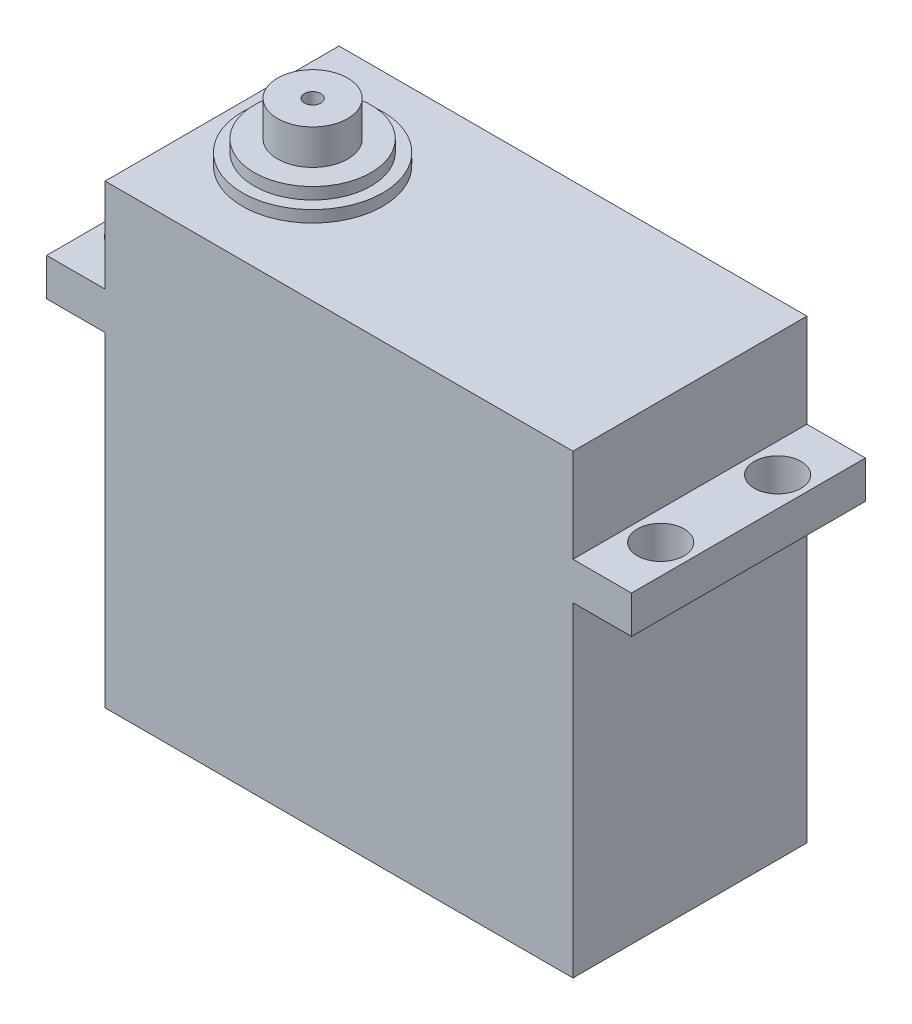
from build123d import *

# Parameters (mm, degrees)
SKETCH_1_W            = 40
SKETCH_1_H            = 39
EXTRUDE_1_DEPTH       = 20
SKETCH_4_W            = 20
SKETCH_4_H            = 3.215179838
EXTRUDE_2_DEPTH       = 5
SKETCH_5_W            = 20
SKETCH_5_H            = 3.215179838
EXTRUDE_3_DEPTH       = 5
SKETCH_7_R            = 2
CUT_EXTRUDE_2_DEPTH   = 3.21517984
SKETCH_8_R            = 2
CUT_EXTRUDE_3_DEPTH   = 3.21517984
EXTRUDE_7_DEPTH       = 1
EXTRUDE_7_DEPTH_BACK  = 39
SKETCH_9_R            = 6
EXTRUDE_9_DEPTH       = 1
EXTRUDE_9_DEPTH_BACK  = 40
SKETCH_10_R           = 5
EXTRUDE_10_DEPTH      = 3
EXTRUDE_10_DEPTH_BACK = 41
SKETCH_11_R           = 3
SKETCH_12_R           = 0.705262345
CUT_EXTRUDE_4_DEPTH   = 40


with BuildPart() as part:
    # 草图1 → 凸台-拉伸1 (new body)
    with BuildSketch(Plane.XY):
        with Locations((-12.988047809, 18.294260929)):
            Rectangle(SKETCH_1_W, SKETCH_1_H)
    extrude(amount=EXTRUDE_1_DEPTH)

    # 草图4 → 凸台-拉伸2 (add)
    with BuildSketch(Plane.ZY.offset(32.988047809)):
        with Locations((10, 28.18667101)):
            Rectangle(SKETCH_4_W, SKETCH_4_H)
    extrude(amount=EXTRUDE_2_DEPTH)

    # 草图5 → 凸台-拉伸3 (add)
    with BuildSketch(Plane(origin=(7.011952191, 0, 0), x_dir=(0, 0, -1), z_dir=(1, 0, 0))):
        with Locations((-10, 28.18667101)):
            Rectangle(SKETCH_5_W, SKETCH_5_H)
    extrude(amount=EXTRUDE_3_DEPTH)

    # 草图7 → 切除-拉伸2 (cut)
    with BuildSketch(Plane(origin=(0, 29.794260929, 0), x_dir=(1, 0, 0), z_dir=(0, 1, 0))):
        with Locations(Location((-35.488047809, -5.338978439, 0), (0, 0, 270))):
            Circle(SKETCH_7_R)
        with Locations(Location((-35.488047809, -14.731505131, 0), (0, 0, 270))):
            Circle(SKETCH_7_R)
    extrude(amount=-CUT_EXTRUDE_2_DEPTH, mode=Mode.SUBTRACT)

    # 草图8 → 切除-拉伸3 (cut)
    with BuildSketch(Plane(origin=(0, 29.794260929, 0), x_dir=(1, 0, 0), z_dir=(0, 1, 0))):
        with Locations(Location((9.511952191, -5, 0), (0, 0, 270))):
            Circle(SKETCH_8_R)
        with Locations(Location((9.511952191, -15, 0), (0, 0, 270))):
            Circle(SKETCH_8_R)
    extrude(amount=-CUT_EXTRUDE_3_DEPTH, mode=Mode.SUBTRACT)

    # 草图9 → 凸台-拉伸7 (add, two sides: drawn at the far end of the back side and taken through both)
    with BuildSketch(Plane(origin=(0, 37.794260929, 0), x_dir=(1, 0, 0), z_dir=(0, 1, 0)).offset(-EXTRUDE_7_DEPTH_BACK)):
        with Locations(Location((-25.244994163, -10, 0), (0, 0, 90))):
            Circle(SKETCH_9_R)
    extrude(amount=EXTRUDE_7_DEPTH + EXTRUDE_7_DEPTH_BACK)

    # 草图10 → 凸台-拉伸9 (add, two sides: drawn at the far end of the back side and taken through both)
    with BuildSketch(Plane(origin=(0, 38.794260929, 0), x_dir=(1, 0, 0), z_dir=(0, 1, 0)).offset(-EXTRUDE_9_DEPTH_BACK)):
        with Locations(Location((-25.244994163, -10, 0), (0, 0, 270))):
            Circle(SKETCH_10_R)
    extrude(amount=EXTRUDE_9_DEPTH + EXTRUDE_9_DEPTH_BACK)

    # 草图11 → 凸台-拉伸10 (add, two sides: drawn at the far end of the back side and taken through both)
    with BuildSketch(Plane(origin=(0, 39.794260929, 0), x_dir=(1, 0, 0), z_dir=(0, 1, 0)).offset(-EXTRUDE_10_DEPTH_BACK)):
        with Locations(Location((-25.244994163, -10, 0), (0, 0, 270))):
            Circle(SKETCH_11_R)
    extrude(amount=EXTRUDE_10_DEPTH + EXTRUDE_10_DEPTH_BACK)

    # 草图12 → 切除-拉伸4 (cut)
    with BuildSketch(Plane(origin=(0, 42.794260929, 0), x_dir=(1, 0, 0), z_dir=(0, 1, 0))):
        with Locations(Location((-25.244994163, -10, 0), (0, 0, 270))):
            Circle(SKETCH_12_R)
    extrude(amount=-CUT_EXTRUDE_4_DEPTH, mode=Mode.SUBTRACT)


solid = part.part
